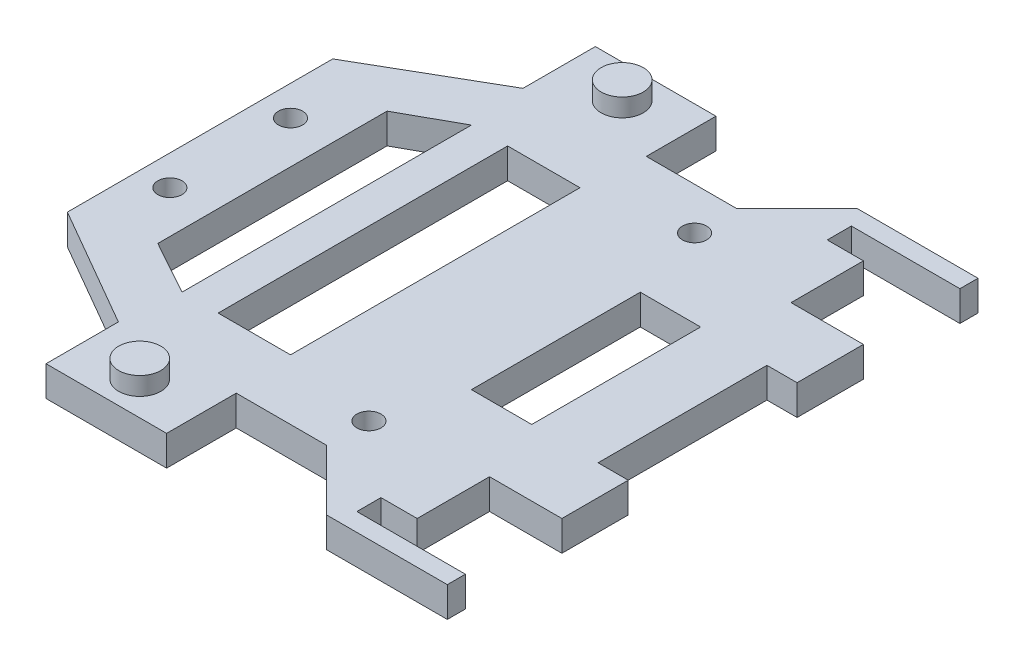
from build123d import *

# Parameters (mm, degrees)
EXTRUDE_1_DEPTH     = 5
SKETCH_2_W          = 12
SKETCH_2_H          = 48
SKETCH_2_W_2        = 10
SKETCH_2_H_2        = 28
SKETCH_2_R          = 2
CUT_EXTRUDE_3_DEPTH = 5
SKETCH_3_R          = 3.5
EXTRUDE_2_DEPTH     = 3


with BuildPart() as part:
    # 草图1 → 凸台-拉伸1 (new body)
    with BuildSketch(Plane(origin=(0, 0, 0), x_dir=(1, 0, 0), z_dir=(0, 1, 0))):
        Polygon((0, -22), (0, 22), (20, 33.547005384), (20, 45.547005384), (40, 45.547005384), (40, 34), (55, 34), (65, 44), (85, 44), (85, 41), (67, 41), (67, 37), (73, 37), (73, 25), (85, 25), (85, 14), (80, 14), (80, -14), (85, -14), (85, -25), (73, -25), (73, -37), (67, -37), (67, -41), (85, -41), (85, -44), (65, -44), (55, -34), (40, -34), (40, -45.547005384), (20, -45.547005384), (20, -33.547005384), align=None)
    extrude(amount=EXTRUDE_1_DEPTH)

    # 草图2 → 切除-拉伸3 (cut)
    with BuildSketch(Plane(origin=(0, 5, 0), x_dir=(1, 0, 0), z_dir=(0, 1, 0))):
        with Locations((33, 0)):
            Rectangle(SKETCH_2_W, SKETCH_2_H)
        with Locations((64, 0)):
            Rectangle(SKETCH_2_W_2, SKETCH_2_H_2)
        Polygon((12, -19), (12, 19), (21, 24), (21, -24), align=None)
        with Locations(Location((5, 10, 0), (0, 0, 270))):
            Circle(SKETCH_2_R)
        with Locations(Location((5, -10, 0), (0, 0, 270))):
            Circle(SKETCH_2_R)
        with Locations(Location((55, -27, 0), (0, 0, 270))):
            Circle(SKETCH_2_R)
        with Locations(Location((55, 27, 0), (0, 0, 270))):
            Circle(SKETCH_2_R)
    extrude(amount=-CUT_EXTRUDE_3_DEPTH, mode=Mode.SUBTRACT)

    # 草图3 → 凸台-拉伸2 (add)
    with BuildSketch(Plane(origin=(0, 5, 0), x_dir=(1, 0, 0), z_dir=(0, 1, 0))):
        with Locations(Location((30, 40, 0), (0, 0, 90))):
            Circle(SKETCH_3_R)
        with Locations(Location((30, -40, 0), (0, 0, 90))):
            Circle(SKETCH_3_R)
    extrude(amount=EXTRUDE_2_DEPTH)


solid = part.part
